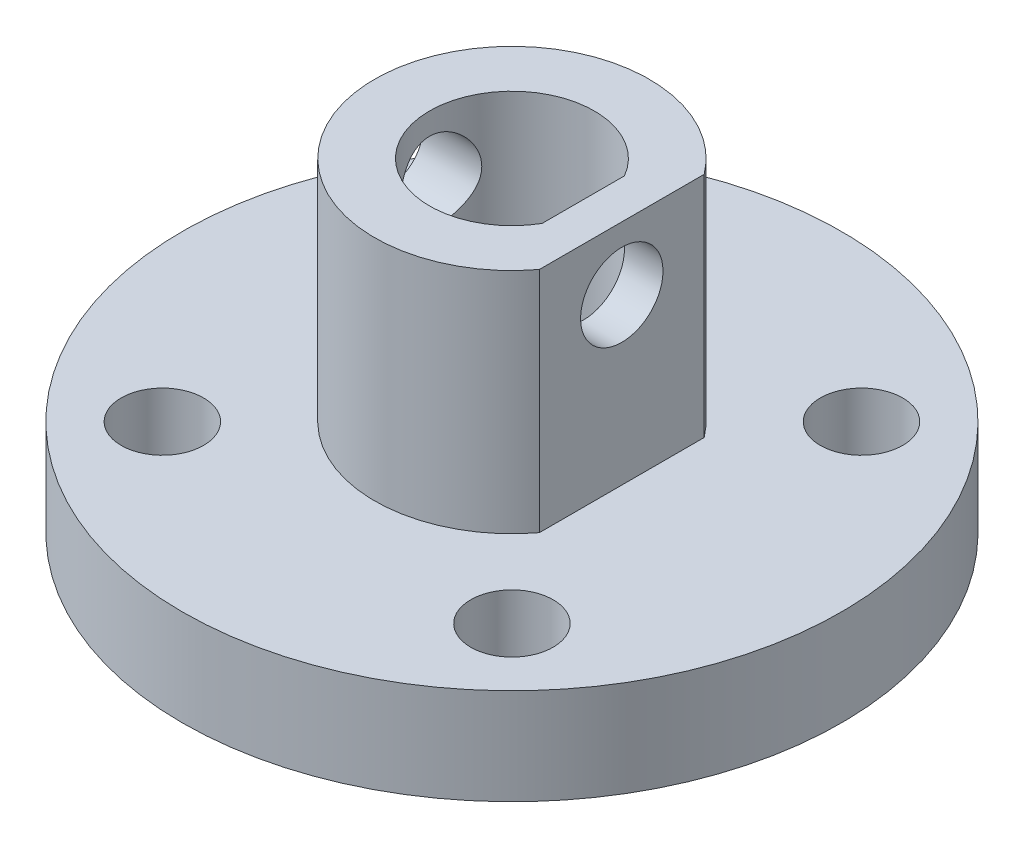
from build123d import *

# Parameters (mm, degrees)
SKETCH1_R           = 12
SKETCH1_R_2         = 1.5
BOSS_EXTRUDE1_DEPTH = 3.5
BOSS_EXTRUDE2_DEPTH = 8.3
SKETCH3_R           = 1.5
CUT_EXTRUDE1_DEPTH  = 19


with BuildPart() as part:
    # Sketch1 → Boss-Extrude1 (new body)
    with BuildSketch(Plane(origin=(0, 0, 0), x_dir=(1, 0, 0), z_dir=(0, 1, 0))):
        with Locations(Location((0, 0, 0), (0, 0, 270))):
            Circle(SKETCH1_R)
        with BuildLine():
            Line((2.598076211, 1.5), (2.598076211, -1.5))
            ThreePointArc((2.598076211, -1.5), (-2.974334584, -0.391578577), (2.121320344, 2.121320344))
            ThreePointArc((2.121320344, 2.121320344), (2.380060021, 1.826284287), (2.598076211, 1.5))
        make_face(mode=Mode.SUBTRACT)
        with Locations(Location((-6.363961031, -6.363961031, 0), (0, 0, 270))):
            Circle(SKETCH1_R_2, mode=Mode.SUBTRACT)
        with Locations(Location((6.363961031, -6.363961031, 0), (0, 0, 270))):
            Circle(SKETCH1_R_2, mode=Mode.SUBTRACT)
        with Locations(Location((-6.363961031, 6.363961031, 0), (0, 0, 270))):
            Circle(SKETCH1_R_2, mode=Mode.SUBTRACT)
        with Locations(Location((6.363961031, 6.363961031, 0), (0, 0, 270))):
            Circle(SKETCH1_R_2, mode=Mode.SUBTRACT)
    extrude(amount=BOSS_EXTRUDE1_DEPTH)

    # Sketch2 → Boss-Extrude2 (add)
    with BuildSketch(Plane(origin=(0, 3.5, 0), x_dir=(1, 0, 0), z_dir=(0, 1, 0))):
        with BuildLine():
            Line((4, -3), (4, 3))
            ThreePointArc((4, 3), (-5, 0), (4, -3))
        make_face()
        with BuildLine():
            Line((2.598076211, 1.5), (2.598076211, -1.5))
            ThreePointArc((2.598076211, -1.5), (-3, 0), (2.598076211, 1.5))
        make_face(mode=Mode.SUBTRACT)
    extrude(amount=BOSS_EXTRUDE2_DEPTH)

    # Sketch3 → Cut-Extrude1 (cut)
    with BuildSketch(Plane(origin=(4, 0, 0), x_dir=(0, 0, -1), z_dir=(1, 0, 0))):
        with Locations((0, 9.5)):
            Circle(SKETCH3_R)
    extrude(amount=-CUT_EXTRUDE1_DEPTH, mode=Mode.SUBTRACT)


solid = part.part
